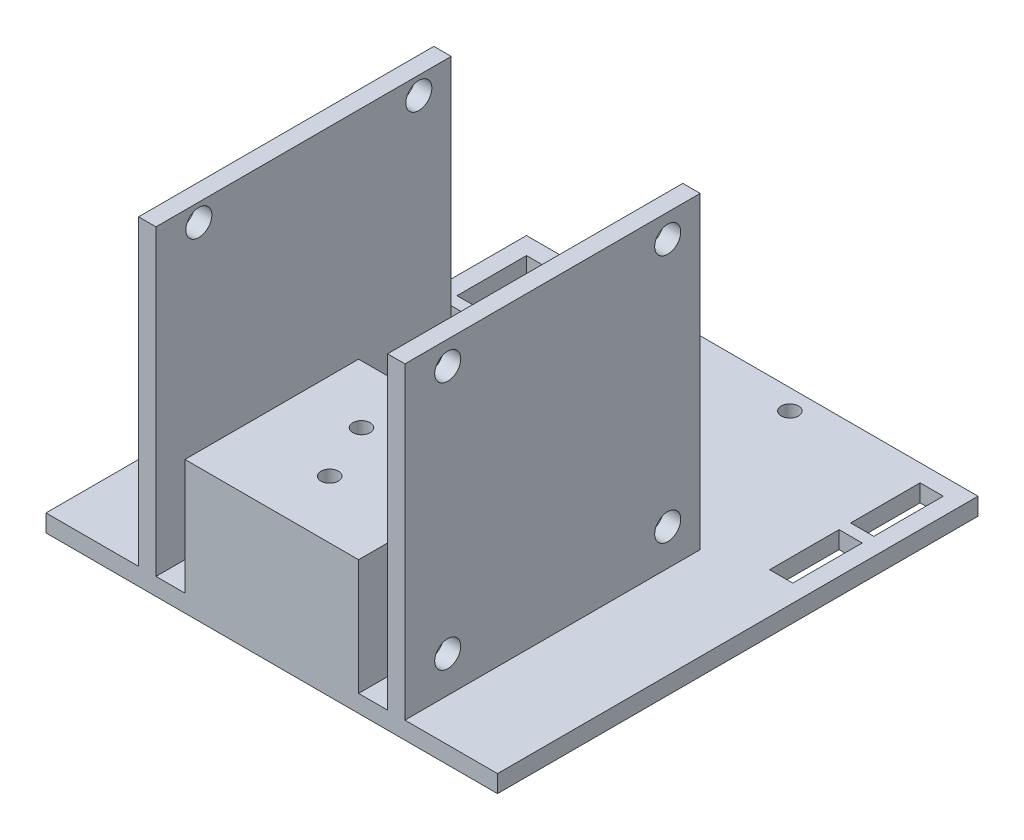
from build123d import *

# Parameters (mm, degrees)
SKETCH1_W            = 148
SKETCH1_H            = 115
BOSS_EXTRUDE4_DEPTH  = 3
SKETCH2_R            = 2.25
CUT_EXTRUDE1_DEPTH   = 3
SKETCH3_R            = 2.25
CUT_EXTRUDE2_DEPTH   = 3
SKETCH4_R            = 2.25
CUT_EXTRUDE3_DEPTH   = 3
SKETCH5_W            = 30
SKETCH5_H            = 30
BOSS_EXTRUDE7_DEPTH  = 20
SKETCH6_R            = 2.25
CUT_EXTRUDE4_DEPTH   = 10
SKETCH7_R            = 1.5
CUT_EXTRUDE5_DEPTH   = 30
SKETCH10_W           = 20
SKETCH10_H           = 51.38
CUT_EXTRUDE6_DEPTH   = 51.3
SKETCH11_W           = 20.353734706
SKETCH11_H           = 51.38
CUT_EXTRUDE7_DEPTH   = 51.3
SKETCH13_W           = 5
SKETCH13_H           = 14
CUT_EXTRUDE8_DEPTH   = 51.3
SKETCH8_W            = 3
SKETCH8_H            = 51
BOSS_EXTRUDE11_DEPTH = 53.3
SKETCH9_W            = 3
SKETCH9_H            = 51
BOSS_EXTRUDE12_DEPTH = 55.3
SKETCH15_R           = 2.25
CUT_EXTRUDE12_DEPTH  = 53.3
SKETCH14_R           = 2.25
CUT_EXTRUDE13_DEPTH  = 53.3
SKETCH17_R           = 2.25
CUT_EXTRUDE14_DEPTH  = 53.3
SKETCH18_W           = 15
SKETCH18_H           = 51.38
CUT_EXTRUDE15_DEPTH  = 10
SKETCH19_W           = 145.001760506
SKETCH19_H           = 61.096648556
BOSS_EXTRUDE13_DEPTH = 3
SKETCH20_R           = 1.5
CUT_EXTRUDE16_DEPTH  = 43
SKETCH21_W           = 109.74816289
SKETCH21_H           = 51.975747058
CUT_EXTRUDE18_DEPTH  = 43
SKETCH23_W           = 39.73104878
SKETCH23_H           = 68.636927329
CUT_EXTRUDE19_DEPTH  = 43
SKETCH24_W           = 37.931057655
SKETCH24_H           = 65.519761518
CUT_EXTRUDE20_DEPTH  = 43
SKETCH25_W           = 4
SKETCH25_H           = 12
CUT_EXTRUDE23_DEPTH  = 43


with BuildPart() as part:
    # Sketch1 → Boss-Extrude4 (new body)
    with BuildSketch(Plane(origin=(0, 0, 0), x_dir=(1, 0, 0), z_dir=(0, 1, 0))):
        with Locations((74, 57.5)):
            Rectangle(SKETCH1_W, SKETCH1_H)
    extrude(amount=BOSS_EXTRUDE4_DEPTH)

    # Sketch2 → Cut-Extrude1 (cut)
    with BuildSketch(Plane(origin=(0, 3, 0), x_dir=(1, 0, 0), z_dir=(0, 1, 0))):
        with Locations(Location((5, 110, 0), (0, 0, 270))):
            Circle(SKETCH2_R)
    extrude(amount=-CUT_EXTRUDE1_DEPTH, mode=Mode.SUBTRACT)

    # Sketch3 → Cut-Extrude2 (cut)
    with BuildSketch(Plane(origin=(0, 3, 0), x_dir=(1, 0, 0), z_dir=(0, 1, 0))):
        with Locations(Location((143, 110, 0), (0, 0, 270))):
            Circle(SKETCH3_R)
    extrude(amount=-CUT_EXTRUDE2_DEPTH, mode=Mode.SUBTRACT)

    # Sketch4 → Cut-Extrude3 (cut)
    with BuildSketch(Plane(origin=(0, 3, 0), x_dir=(1, 0, 0), z_dir=(0, 1, 0))):
        with Locations(Location((5, 56, 0), (0, 0, 270))):
            Circle(SKETCH4_R)
    extrude(amount=-CUT_EXTRUDE3_DEPTH, mode=Mode.SUBTRACT)

    # Sketch5 → Boss-Extrude7 (add)
    with BuildSketch(Plane(origin=(0, 3, 0), x_dir=(1, 0, 0), z_dir=(0, 1, 0))):
        with Locations((74, 15)):
            Rectangle(SKETCH5_W, SKETCH5_H)
    extrude(amount=BOSS_EXTRUDE7_DEPTH)

    # Sketch6 → Cut-Extrude4 (cut)
    with BuildSketch(Plane(origin=(0, 3, 0), x_dir=(1, 0, 0), z_dir=(0, 1, 0))):
        with Locations(Location((20, 110, 0), (0, 0, 270))):
            Circle(SKETCH6_R)
        with Locations(Location((35, 110, 0), (0, 0, 270))):
            Circle(SKETCH6_R)
        with Locations(Location((20, 56, 0), (0, 0, 270))):
            Circle(SKETCH6_R)
        with Locations(Location((35, 56, 0), (0, 0, 270))):
            Circle(SKETCH6_R)
        with Locations(Location((128, 110, 0), (0, 0, 270))):
            Circle(SKETCH6_R)
        with Locations(Location((113, 110, 0), (0, 0, 270))):
            Circle(SKETCH6_R)
        with Locations(Location((113, 56, 0), (0, 0, 270))):
            Circle(SKETCH6_R)
        with Locations(Location((128, 56, 0), (0, 0, 270))):
            Circle(SKETCH6_R)
        with Locations(Location((143, 56, 0), (0, 0, 270))):
            Circle(SKETCH6_R)
    extrude(amount=-CUT_EXTRUDE4_DEPTH, mode=Mode.SUBTRACT)

    # Sketch7 → Cut-Extrude5 (cut)
    with BuildSketch(Plane(origin=(0, 23, 0), x_dir=(1, 0, 0), z_dir=(0, 1, 0))):
        with Locations(Location((69.5, 20, 0), (0, 0, 270))):
            Circle(SKETCH7_R)
        with Locations(Location((74, 10, 0), (0, 0, 270))):
            Circle(SKETCH7_R)
        with Locations(Location((78.5, 20, 0), (0, 0, 270))):
            Circle(SKETCH7_R)
    extrude(amount=-CUT_EXTRUDE5_DEPTH, mode=Mode.SUBTRACT)

    # Sketch10 → Cut-Extrude6 (cut)
    with BuildSketch(Plane(origin=(0, 3, 0), x_dir=(1, 0, 0), z_dir=(0, 1, 0))):
        with Locations((138, 25.69)):
            Rectangle(SKETCH10_W, SKETCH10_H)
    extrude(amount=-CUT_EXTRUDE6_DEPTH, mode=Mode.SUBTRACT)

    # Sketch11 → Cut-Extrude7 (cut)
    with BuildSketch(Plane(origin=(0, 3, 0), x_dir=(1, 0, 0), z_dir=(0, 1, 0))):
        with Locations((9.823132647, 25.69)):
            Rectangle(SKETCH11_W, SKETCH11_H)
    extrude(amount=-CUT_EXTRUDE7_DEPTH, mode=Mode.SUBTRACT)

    # Sketch13 → Cut-Extrude8 (cut)
    with BuildSketch(Plane(origin=(0, 3, 0), x_dir=(1, 0, 0), z_dir=(0, 1, 0))):
        with Locations((27.5, 39)):
            Rectangle(SKETCH13_W, SKETCH13_H)
        with Locations((27.5, 23)):
            Rectangle(SKETCH13_W, SKETCH13_H)
        with Locations((120.5, 39)):
            Rectangle(SKETCH13_W, SKETCH13_H)
        with Locations((120.5, 23)):
            Rectangle(SKETCH13_W, SKETCH13_H)
    extrude(amount=-CUT_EXTRUDE8_DEPTH, mode=Mode.SUBTRACT)

    # Sketch8 → Boss-Extrude11 (add)
    with BuildSketch(Plane(origin=(0, 3, 0), x_dir=(1, 0, 0), z_dir=(0, 1, 0))):
        with Locations((95.5, 25.5)):
            Rectangle(SKETCH8_W, SKETCH8_H)
    extrude(amount=BOSS_EXTRUDE11_DEPTH)

    # Sketch9 → Boss-Extrude12 (add)
    with BuildSketch(Plane(origin=(0, 0, 0), x_dir=(-1, 0, 0), z_dir=(0, -1, 0))):
        with Locations((-52.5, 25.5)):
            Rectangle(SKETCH9_W, SKETCH9_H)
    extrude(amount=-BOSS_EXTRUDE12_DEPTH)

    # Sketch15 → Cut-Extrude12 (cut)
    with BuildSketch(Plane(origin=(97, 0, 0), x_dir=(0, 0, -1), z_dir=(1, 0, 0))):
        with Locations((45.4, 9.25)):
            Circle(SKETCH15_R)
    extrude(amount=-CUT_EXTRUDE12_DEPTH, mode=Mode.SUBTRACT)

    # Sketch14 → Cut-Extrude13 (cut)
    with BuildSketch(Plane(origin=(97, 0, 0), x_dir=(0, 0, -1), z_dir=(1, 0, 0))):
        with Locations((45.4, 52.25)):
            Circle(SKETCH14_R)
        with Locations((7.4, 9.25)):
            Circle(SKETCH14_R)
    extrude(amount=-CUT_EXTRUDE13_DEPTH, mode=Mode.SUBTRACT)

    # Sketch17 → Cut-Extrude14 (cut)
    with BuildSketch(Plane(origin=(97, 0, 0), x_dir=(0, 0, -1), z_dir=(1, 0, 0))):
        with Locations((7.4, 52.25)):
            Circle(SKETCH17_R)
    extrude(amount=-CUT_EXTRUDE14_DEPTH, mode=Mode.SUBTRACT)

    # Sketch18 → Cut-Extrude15 (cut)
    with BuildSketch(Plane(origin=(0, 3, 0), x_dir=(1, 0, 0), z_dir=(0, 1, 0))):
        with Locations((120.5, 25.69)):
            Rectangle(SKETCH18_W, SKETCH18_H)
        with Locations((27.5, 25.69)):
            Rectangle(SKETCH18_W, SKETCH18_H)
    extrude(amount=-CUT_EXTRUDE15_DEPTH, mode=Mode.SUBTRACT)

    # Sketch19 → Boss-Extrude13 (add)
    with BuildSketch(Plane(origin=(0, 3, 0), x_dir=(1, 0, 0), z_dir=(0, 1, 0))):
        with Locations((74.214102408, 83.006974137)):
            Rectangle(SKETCH19_W, SKETCH19_H)
    extrude(amount=-BOSS_EXTRUDE13_DEPTH)

    # Sketch20 → Cut-Extrude16 (cut)
    with BuildSketch(Plane(origin=(0, 3, 0), x_dir=(1, 0, 0), z_dir=(0, 1, 0))):
        with Locations(Location((64, 79.5, 0), (0, 0, 270))):
            Circle(SKETCH20_R)
        with Locations(Location((84, 79.5, 0), (0, 0, 270))):
            Circle(SKETCH20_R)
        with Locations(Location((64, 54.5, 0), (0, 0, 270))):
            Circle(SKETCH20_R)
        with Locations(Location((84, 54.5, 0), (0, 0, 270))):
            Circle(SKETCH20_R)
    extrude(amount=-CUT_EXTRUDE16_DEPTH, mode=Mode.SUBTRACT)

    # Sketch21 → Cut-Extrude18 (cut)
    with BuildSketch(Plane(origin=(0, 0, 0), x_dir=(-1, 0, 0), z_dir=(0, -1, 0))):
        with Locations((-79.874081445, 108.987873529)):
            Rectangle(SKETCH21_W, SKETCH21_H)
    extrude(amount=-CUT_EXTRUDE18_DEPTH, mode=Mode.SUBTRACT)

    # Sketch23 → Cut-Extrude19 (cut)
    with BuildSketch(Plane.XZ):
        with Locations((132.86552439, -85.698463665)):
            Rectangle(SKETCH23_W, SKETCH23_H)
    extrude(amount=-CUT_EXTRUDE19_DEPTH, mode=Mode.SUBTRACT)

    # Sketch24 → Cut-Extrude20 (cut)
    with BuildSketch(Plane(origin=(0, 0, 0), x_dir=(-1, 0, 0), z_dir=(0, -1, 0))):
        with Locations((-16.034471172, 84.139880759)):
            Rectangle(SKETCH24_W, SKETCH24_H)
    extrude(amount=-CUT_EXTRUDE20_DEPTH, mode=Mode.SUBTRACT)

    # Sketch25 → Cut-Extrude23 (cut)
    with BuildSketch(Plane.XZ):
        with Locations((40, -74)):
            Rectangle(SKETCH25_W, SKETCH25_H)
        with Locations((40, -60)):
            Rectangle(SKETCH25_W, SKETCH25_H)
        with Locations((108, -74)):
            Rectangle(SKETCH25_W, SKETCH25_H)
        with Locations((108, -60)):
            Rectangle(SKETCH25_W, SKETCH25_H)
    extrude(amount=-CUT_EXTRUDE23_DEPTH, mode=Mode.SUBTRACT)


solid = part.part
